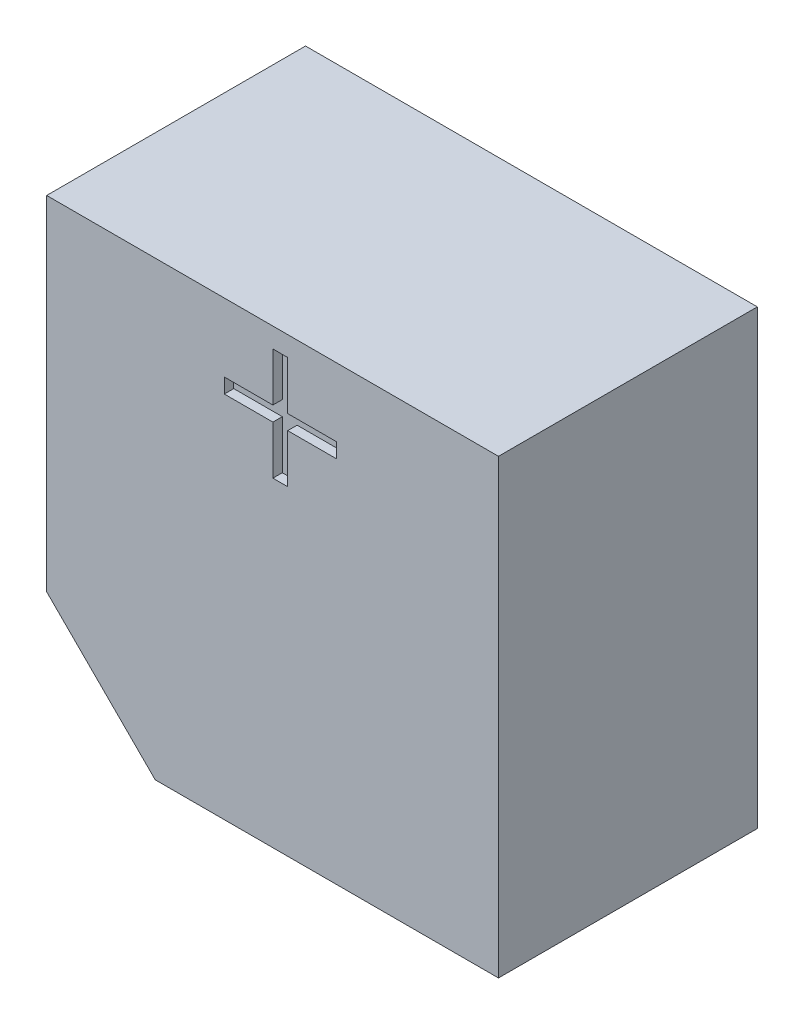
from build123d import *

# Parameters (mm, degrees)
BOSS_EXTRU_1_DEPTH      = 5.5
ENL_V_MAT_EXTRU_1_DEPTH = 0.2


with BuildPart() as part:
    # Esquisse3 → Boss.-Extru.1 (new body)
    with BuildSketch(Plane.XY):
        Polygon((0, 9.6), (9.6, 9.6), (9.6, 0), (2.306440558, 0), (0, 2.306440558), align=None)
    extrude(amount=BOSS_EXTRU_1_DEPTH)

    # Esquisse4 → Enlèv. mat.-Extru.1 (cut)
    with BuildSketch(Plane.XY.offset(5.5)):
        Polygon((4.806969946, 8.146939157), (4.806969946, 9.178990439), (5.12107251, 9.178990439), (5.12107251, 8.146939157), (6.153123792, 8.146939157), (6.153123792, 7.832836593), (5.12107251, 7.832836593), (5.12107251, 6.800785311), (4.806969946, 6.800785311), (4.806969946, 7.832836593), (3.774918664, 7.832836593), (3.774918664, 8.146939157), align=None)
    extrude(amount=-ENL_V_MAT_EXTRU_1_DEPTH, mode=Mode.SUBTRACT)


solid = part.part
